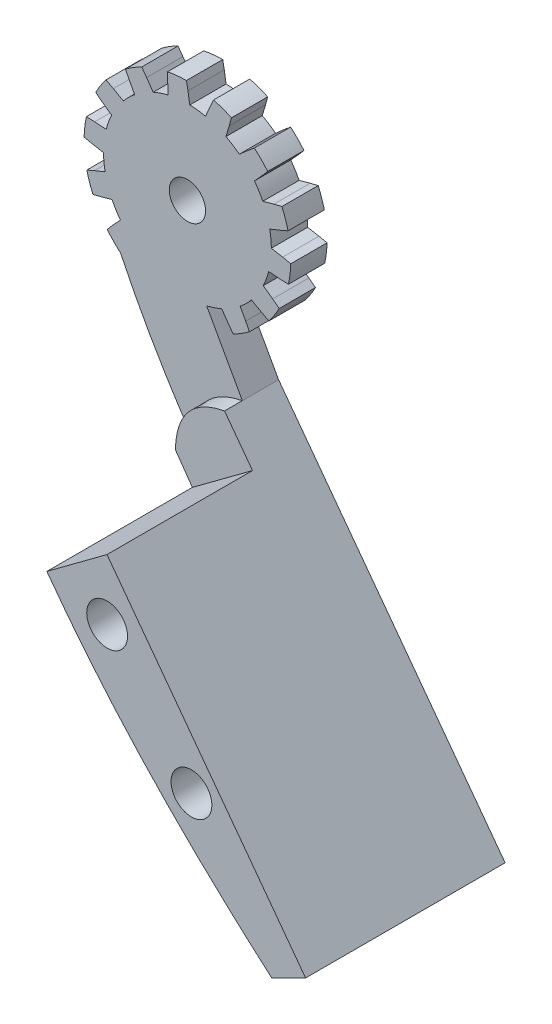
from build123d import *

# Parameters (mm, degrees)
BOSS_EXTRUDE1_DEPTH = 4
BOSS_EXTRUDE3_DEPTH = 4
SKETCH6_R           = 2
CUT_EXTRUDE1_DEPTH  = 18
BOSS_EXTRUDE4_DEPTH = 18
SKETCH8_R           = 2.25
CUT_EXTRUDE2_DEPTH  = 68.060778195
SKETCH10_W          = 25.230248524
SKETCH10_H          = 17.693033904
CUT_EXTRUDE4_DEPTH  = 66.862040733


with BuildPart() as part:
    # Sketch2 → Boss-Extrude1 (new body)
    with BuildSketch(Plane.XY):
        with BuildLine():
            Line((17.593003447, 3.447921134), (18.432689254, 3.812129579))
            ThreePointArc((18.432689254, 3.812129579), (18.142308848, 4.822341152), (17.760116965, 5.801513031))
            Line((17.760116965, 5.801513031), (16.871688472, 5.581479263))
            Line((16.871688472, 5.581479263), (15.649099733, 5.241598415))
            ThreePointArc((15.649099733, 5.241598415), (15.22663553, 6.009376293), (14.733410626, 6.733729845))
            Line((14.733410626, 6.733729845), (15.590096731, 7.669855443))
            Line((15.590096731, 7.669855443), (16.188603379, 8.362321932))
            ThreePointArc((16.188603379, 8.362321932), (15.488665299, 9.146499772), (14.719475556, 9.862876308))
            Line((14.719475556, 9.862876308), (14.014498216, 9.279158058))
            Line((14.014498216, 9.279158058), (13.060452596, 8.442474621))
            ThreePointArc((13.060452596, 8.442474621), (12.346699165, 8.950918239), (11.588033655, 9.389535972))
            Line((11.588033655, 9.389535972), (11.95371149, 10.604658163))
            Line((11.95371149, 10.604658163), (12.192497398, 11.488231214))
            ThreePointArc((12.192497398, 11.488231214), (11.221632964, 11.891059284), (10.217792822, 12.202753318))
            Line((10.217792822, 12.202753318), (9.835896044, 11.370963143))
            Line((9.835896044, 11.370963143), (9.33935398, 10.203192533))
            ThreePointArc((9.33935398, 10.203192533), (8.475678941, 10.351598396), (7.601835833, 10.417606691))
            Line((7.601835833, 10.417606691), (7.404078418, 11.671055622))
            Line((7.404078418, 11.671055622), (7.235849109, 12.570732756))
            ThreePointArc((7.235849109, 12.570732756), (6.18634993, 12.512426015), (5.14668224, 12.357702722))
            Line((5.14668224, 12.357702722), (5.163505363, 11.442586867))
            Line((5.163505363, 11.442586867), (5.222813101, 10.175020376))
            ThreePointArc((5.222813101, 10.175020376), (4.380277888, 9.933994883), (3.564332526, 9.614319987))
            Line((3.564332526, 9.614319987), (2.842308143, 10.657834724))
            Line((2.842308143, 10.657834724), (2.300383494, 11.395423851))
            ThreePointArc((2.300383494, 11.395423851), (1.380115753, 10.887530665), (0.510539453, 10.297034891))
            Line((0.510539453, 10.297034891), (0.922750452, 9.479843274))
            Line((0.922750452, 9.479843274), (1.526161366, 8.363537991))
            ThreePointArc((1.526161366, 8.363537991), (0.871640411, 7.780819197), (0.275200782, 7.138776643))
            Line((0.275200782, 7.138776643), (-0.828084785, 7.765676295))
            Line((-0.828084785, 7.765676295), (-1.636369952, 8.195088843))
            ThreePointArc((-1.636369952, 8.195088843), (-2.245135941, 7.338203686), (-2.772390602, 6.42889036))
            Line((-2.772390602, 6.42889036), (-2.04643517, 5.871477804))
            Line((-2.04643517, 5.871477804), (-1.018434012, 5.12753168))
            ThreePointArc((-1.018434012, 5.12753168), (-1.355304806, 4.318534189), (-1.61410652, 3.481288379))
            Line((-1.61410652, 3.481288379), (-2.880134034, 3.567407782))
            Line((-2.880134034, 3.567407782), (-3.794688927, 3.603593329))
            ThreePointArc((-3.794688927, 3.603593329), (-3.971379595, 2.567432815), (-4.051883364, 1.519402593))
            Line((-4.051883364, 1.519402593), (-3.155967876, 1.332171491))
            Line((-3.155967876, 1.332171491), (-1.90698471, 1.107932181))
            ThreePointArc((-1.90698471, 1.107932181), (-1.859483953, 0.232887867), (-1.729388897, -0.633734398))
            Line((-1.729388897, -0.633734398), (-2.907406081, -1.105452248))
            Line((-2.907406081, -1.105452248), (-3.747091888, -1.469660694))
            ThreePointArc((-3.747091888, -1.469660694), (-3.456711482, -2.479872267), (-3.0745196, -3.459044145))
            Line((-3.0745196, -3.459044145), (-2.186091107, -3.239010378))
            Line((-2.186091107, -3.239010378), (-0.963502367, -2.899129529))
            ThreePointArc((-0.963502367, -2.899129529), (-0.541038164, -3.666907408), (-0.047813261, -4.391260959))
            Line((-0.047813261, -4.391260959), (-0.904499365, -5.327386558))
            Line((-0.904499365, -5.327386558), (-1.503006014, -6.019853046))
            ThreePointArc((-1.503006014, -6.019853046), (-0.803067933, -6.804030887), (-0.03387819, -7.520407423))
            Line((-0.03387819, -7.520407423), (0.67109915, -6.936689172))
            Line((0.67109915, -6.936689172), (1.625144769, -6.100005735))
            ThreePointArc((1.625144769, -6.100005735), (2.3388982, -6.608449353), (3.097563711, -7.047067087))
            Line((3.097563711, -7.047067087), (2.731885876, -8.262189278))
            Line((2.731885876, -8.262189278), (2.493099968, -9.145762328))
            ThreePointArc((2.493099968, -9.145762328), (3.463964401, -9.548590398), (4.467804544, -9.860284433))
            Line((4.467804544, -9.860284433), (4.849701322, -9.028494257))
            Line((4.849701322, -9.028494257), (5.346243386, -7.860723648))
            ThreePointArc((5.346243386, -7.860723648), (6.209918425, -8.009129511), (7.083761533, -8.075137806))
            Line((7.083761533, -8.075137806), (7.281518948, -9.328586736))
            Line((7.281518948, -9.328586736), (7.449748257, -10.22826387))
            ThreePointArc((7.449748257, -10.22826387), (8.499247436, -10.16995713), (9.538915126, -10.015233837))
            Line((9.538915126, -10.015233837), (9.522092003, -9.100117982))
            Line((9.522092003, -9.100117982), (9.462784265, -7.83255149))
            ThreePointArc((9.462784265, -7.83255149), (10.305319478, -7.591525998), (11.12126484, -7.271851101))
            Line((11.12126484, -7.271851101), (11.843289223, -8.315365839))
            Line((11.843289223, -8.315365839), (12.385213872, -9.052954966))
            ThreePointArc((12.385213872, -9.052954966), (13.305481612, -8.54506178), (14.175057913, -7.954566005))
            Line((14.175057913, -7.954566005), (13.762846914, -7.137374389))
            Line((13.762846914, -7.137374389), (13.159436, -6.021069105))
            ThreePointArc((13.159436, -6.021069105), (13.813956955, -5.438350311), (14.410396584, -4.796307757))
            Line((14.410396584, -4.796307757), (15.513682151, -5.42320741))
            Line((15.513682151, -5.42320741), (16.321967317, -5.852619957))
            ThreePointArc((16.321967317, -5.852619957), (16.930733307, -4.9957348), (17.457987967, -4.086421474))
            Line((17.457987967, -4.086421474), (16.732032536, -3.529008918))
            Line((16.732032536, -3.529008918), (15.704031377, -2.785062794))
            ThreePointArc((15.704031377, -2.785062794), (16.040902172, -1.976065303), (16.299703886, -1.138819493))
            Line((16.299703886, -1.138819493), (17.565731399, -1.224938896))
            Line((17.565731399, -1.224938896), (18.480286292, -1.261124443))
            ThreePointArc((18.480286292, -1.261124443), (18.656976961, -0.22496393), (18.737480729, 0.823066292))
            Line((18.737480729, 0.823066292), (17.841565242, 1.010297394))
            Line((17.841565242, 1.010297394), (16.592582076, 1.234536705))
            ThreePointArc((16.592582076, 1.234536705), (16.545081318, 2.109581019), (16.414986263, 2.976203284))
            Line((16.414986263, 2.976203284), (17.593003447, 3.447921134))
        make_face()
    extrude(amount=-BOSS_EXTRUDE1_DEPTH)

    # Sketch5 → Boss-Extrude3 (add)
    with BuildSketch(Plane.XY):
        with BuildLine():
            Line((34.627961915, -50.407866333), (38.369192873, -48.55177457))
            Line((38.369192873, -48.55177457), (13.393984011, -14.920355903))
            Line((13.393984011, -14.920355903), (9.462784265, -7.83255149))
            Line((9.462784265, -7.83255149), (0.865656202, -2.843190202))
            Line((0.865656202, -2.843190202), (-0.03387819, -7.520407423))
            add(Edge.make_bspline(
                [(34.627961915, -50.407866333), (20.737528927, -38.343464696), (7.957182105, -24.264537371), (-0.03387819, -7.520407423)],
                knots=[0, 0, 0, 0, 1, 1, 1, 1], degree=3))
        make_face()
    extrude(amount=-BOSS_EXTRUDE3_DEPTH)

    # Sketch6 → Cut-Extrude1 (cut)
    with BuildSketch(Plane(origin=(0, 0, -4), x_dir=(-1, 0, 0), z_dir=(0, 0, -1))):
        with Locations((-7.342798683, 1.171234443)):
            Circle(SKETCH6_R)
    extrude(amount=-CUT_EXTRUDE1_DEPTH, mode=Mode.SUBTRACT)

    # Sketch7 → Boss-Extrude4 (add)
    with BuildSketch(Plane.XY):
        with BuildLine():
            Line((34.627961915, -50.407866333), (38.369192873, -48.55177457))
            Line((38.369192873, -48.55177457), (13.393984011, -14.920355903))
            add(Edge.make_bspline(
                [(7.977955023, -21.345123668), (8.112113434, -15.921271934), (13.393984011, -14.920355903)],
                knots=[0, 0, 0, 1, 1, 1], degree=2))
            add(Edge.make_bspline(
                [(7.977955023, -21.345123668), (15.413845314, -32.210109704), (24.739621619, -41.819443715), (34.627961915, -50.407866333)],
                knots=[0.288118642, 0.288118642, 0.288118642, 0.288118642, 1, 1, 1, 1], degree=3))
        make_face()
    extrude(amount=BOSS_EXTRUDE4_DEPTH)

    # Sketch8 → Cut-Extrude2 (cut, through all)
    with BuildSketch(Plane(origin=(0, 0, -4), x_dir=(-1, 0, 0), z_dir=(0, 0, -1))):
        with Locations((-16.490179828, -25.746560684)):
            Circle(SKETCH8_R)
        with Locations((-25.785580409, -37.215397344)):
            Circle(SKETCH8_R)
    extrude(amount=-CUT_EXTRUDE2_DEPTH, mode=Mode.SUBTRACT)

    # Sketch10 → Cut-Extrude4 (cut, through all)
    with BuildSketch(Plane(origin=(1.491415785, 1.107548305, 0), x_dir=(0, 0, -1), z_dir=(0.8028367498889462, 0.5961989206865052, 0))):
        with Locations((-14.573721534, -16.286562524)):
            Rectangle(SKETCH10_W, SKETCH10_H)
    extrude(amount=-CUT_EXTRUDE4_DEPTH, mode=Mode.SUBTRACT)


solid = part.part
